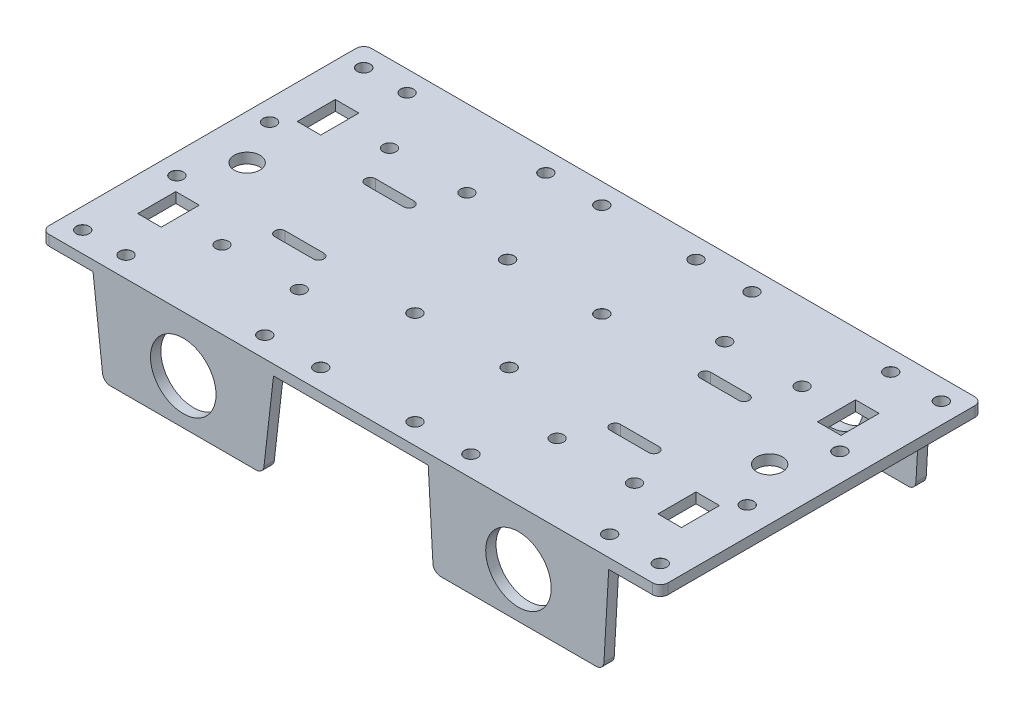
from build123d import *

# Parameters (mm, degrees)
SKETCH_2_W                      = 240
SKETCH_2_H                      = 125
EXTRUDE_1_DEPTH                 = 4
FILLET_1_R                      = 3
SKETCH_4_W                      = 70
SKETCH_4_H                      = 4
EXTRUDE_3_DEPTH                 = 35
CUT_EXTRUDE_1_DEPTH             = 177.776695297
CUT_EXTRUDE_1_DEPTH_BACK        = 177.776695297
CUT_EXTRUDE_2_DEPTH             = 177.776695297
CUT_EXTRUDE_2_DEPTH_BACK        = 177.776695297
FILLET_2_R                      = 3
FILLET_3_R                      = 3
CUT_EXTRUDE_3_DEPTH             = 177.776695297
CUT_EXTRUDE_3_DEPTH_BACK        = 177.776695297
SKETCH_10_R                     = 12.7
CUT_EXTRUDE_4_REACH             = 142.809
SKETCH_11_R                     = 2.5
CUT_EXTRUDE_4_DIRECTION_2_DEPTH = 141.809268161
HOLE_WIZARD_5_0_5_4_D           = 5
HOLE_WIZARD_5_0_5_4_CSINK_D     = 5.05
HOLE_WIZARD_5_0_5_4_CSINK_ANGLE = 90
HOLE_WIZARD_5_0_5_5_D           = 5
HOLE_WIZARD_5_0_5_5_CSINK_D     = 5.05
HOLE_WIZARD_5_0_5_5_CSINK_ANGLE = 90
SKETCH_26_W                     = 9.130018581
SKETCH_26_H                     = 14.776214284
CUT_EXTRUDE_5_DEPTH             = 10
SKETCH_22_R                     = 5
CUT_EXTRUDE_6_DEPTH             = 10


with BuildPart() as part:
    # 草图2 → 凸台-拉伸1 (new body)
    with BuildSketch(Plane(origin=(0, 0, 0), x_dir=(1, 0, 0), z_dir=(0, 1, 0))):
        Rectangle(SKETCH_2_W, SKETCH_2_H)
    extrude(amount=EXTRUDE_1_DEPTH)

    # 圆角1
    fillet_1_edges = [part.edges().sort_by_distance(p)[0] for p in [
        (120, 2, 62.5),
        (-120, 2, 62.5),
        (-120, 2, -62.5),
        (120, 2, -62.5),
    ]]
    fillet(fillet_1_edges, radius=FILLET_1_R)

    # 草图4 → 凸台-拉伸3 (add)
    with BuildSketch(Plane.XZ):
        with Locations((65, 60.5)):
            Rectangle(SKETCH_4_W, SKETCH_4_H)
        with Locations((-65, 60.5)):
            Rectangle(SKETCH_4_W, SKETCH_4_H)
        with Locations((65, -60.5)):
            Rectangle(SKETCH_4_W, SKETCH_4_H)
        with Locations((-65, -60.5)):
            Rectangle(SKETCH_4_W, SKETCH_4_H)
    extrude(amount=EXTRUDE_3_DEPTH)

    # 草图7 → 切除-拉伸1 (cut, two sides: drawn at the far end of the back side and taken through both)
    with BuildSketch(Plane.XY.offset(62.5).offset(-CUT_EXTRUDE_1_DEPTH_BACK)):
        Polygon((-100, 0), (-96, -35), (-100, -35), align=None)
        Polygon((-30, 0), (-34, -35), (-30, -35), align=None)
    extrude(amount=CUT_EXTRUDE_1_DEPTH + CUT_EXTRUDE_1_DEPTH_BACK, mode=Mode.SUBTRACT)

    # 草图9 → 切除-拉伸2 (cut, two sides: drawn at the far end of the back side and taken through both)
    with BuildSketch(Plane.XY.offset(62.5).offset(-CUT_EXTRUDE_2_DEPTH_BACK)):
        Polygon((30, 0), (32, -35), (30, -35), align=None)
        Polygon((98, -35), (100, -35), (100, 0), align=None)
    extrude(amount=CUT_EXTRUDE_2_DEPTH + CUT_EXTRUDE_2_DEPTH_BACK, mode=Mode.SUBTRACT)

    # 圆角2
    fillet_2_edges = [part.edges().sort_by_distance(p)[0] for p in [
        (-96, -35, 60.5),
    ]]
    fillet(fillet_2_edges, radius=FILLET_2_R)

    # 圆角3
    fillet_3_edges = [part.edges().sort_by_distance(p)[0] for p in [
        (98, -35, -60.5),
        (32, -35, -60.5),
        (98, -35, 60.5),
        (32, -35, 60.5),
        (-34, -35, -60.5),
        (-96, -35, -60.5),
        (-34, -35, 60.5),
    ]]
    fillet(fillet_3_edges, radius=FILLET_3_R)

    # 草图10 → 切除-拉伸3 (cut, two sides: drawn at the far end of the back side and taken through both)
    with BuildSketch(Plane.XY.offset(62.5).offset(-CUT_EXTRUDE_3_DEPTH_BACK)):
        with Locations((-65, -17.5)):
            Circle(SKETCH_10_R)
        with Locations(Location((65, -17.5, 0), (0, 0, 180))):
            Circle(SKETCH_10_R)
    extrude(amount=CUT_EXTRUDE_3_DEPTH + CUT_EXTRUDE_3_DEPTH_BACK, mode=Mode.SUBTRACT)

    # 草图11 → 切除-拉伸4 (cut, up to next)
    with BuildSketch(Plane(origin=(0, 4, 0), x_dir=(1, 0, 0), z_dir=(0, 1, 0)), mode=Mode.PRIVATE) as cut_extrude_4_sk1:
        with Locations(Location((-80, -32.5, 0), (0, 0, 90))):
            Circle(SKETCH_11_R)
    cut_extrude_4_tool1 = extrude(cut_extrude_4_sk1.sketch, amount=-CUT_EXTRUDE_4_REACH, mode=Mode.PRIVATE) & part.part
    # 草图11 → 切除-拉伸4 (cut, up to next)
    with BuildSketch(Plane(origin=(0, 4, 0), x_dir=(1, 0, 0), z_dir=(0, 1, 0)), mode=Mode.PRIVATE) as cut_extrude_4_sk2:
        with Locations(Location((-50, -32.5, 0), (0, 0, 90))):
            Circle(SKETCH_11_R)
    cut_extrude_4_tool2 = extrude(cut_extrude_4_sk2.sketch, amount=-CUT_EXTRUDE_4_REACH, mode=Mode.PRIVATE) & part.part
    # 草图11 → 切除-拉伸4 (cut, up to next)
    with BuildSketch(Plane(origin=(0, 4, 0), x_dir=(1, 0, 0), z_dir=(0, 1, 0)), mode=Mode.PRIVATE) as cut_extrude_4_sk3:
        with Locations(Location((-50, 32.5, 0), (0, 0, 90))):
            Circle(SKETCH_11_R)
    cut_extrude_4_tool3 = extrude(cut_extrude_4_sk3.sketch, amount=-CUT_EXTRUDE_4_REACH, mode=Mode.PRIVATE) & part.part
    # 草图11 → 切除-拉伸4 (cut, up to next)
    with BuildSketch(Plane(origin=(0, 4, 0), x_dir=(1, 0, 0), z_dir=(0, 1, 0)), mode=Mode.PRIVATE) as cut_extrude_4_sk4:
        with Locations(Location((-80, 32.5, 0), (0, 0, 90))):
            Circle(SKETCH_11_R)
    cut_extrude_4_tool4 = extrude(cut_extrude_4_sk4.sketch, amount=-CUT_EXTRUDE_4_REACH, mode=Mode.PRIVATE) & part.part
    # 草图11 → 切除-拉伸4 (cut, up to next)
    with BuildSketch(Plane(origin=(0, 4, 0), x_dir=(1, 0, 0), z_dir=(0, 1, 0)), mode=Mode.PRIVATE) as cut_extrude_4_sk5:
        with Locations(Location((50, -32.5, 0), (0, 0, 90))):
            Circle(SKETCH_11_R)
    cut_extrude_4_tool5 = extrude(cut_extrude_4_sk5.sketch, amount=-CUT_EXTRUDE_4_REACH, mode=Mode.PRIVATE) & part.part
    # 草图11 → 切除-拉伸4 (cut, up to next)
    with BuildSketch(Plane(origin=(0, 4, 0), x_dir=(1, 0, 0), z_dir=(0, 1, 0)), mode=Mode.PRIVATE) as cut_extrude_4_sk6:
        with Locations(Location((50, 32.5, 0), (0, 0, 90))):
            Circle(SKETCH_11_R)
    cut_extrude_4_tool6 = extrude(cut_extrude_4_sk6.sketch, amount=-CUT_EXTRUDE_4_REACH, mode=Mode.PRIVATE) & part.part
    # 草图11 → 切除-拉伸4 (cut, up to next)
    with BuildSketch(Plane(origin=(0, 4, 0), x_dir=(1, 0, 0), z_dir=(0, 1, 0)), mode=Mode.PRIVATE) as cut_extrude_4_sk7:
        with Locations(Location((80, -32.5, 0), (0, 0, 90))):
            Circle(SKETCH_11_R)
    cut_extrude_4_tool7 = extrude(cut_extrude_4_sk7.sketch, amount=-CUT_EXTRUDE_4_REACH, mode=Mode.PRIVATE) & part.part
    # 草图11 → 切除-拉伸4 (cut, up to next)
    with BuildSketch(Plane(origin=(0, 4, 0), x_dir=(1, 0, 0), z_dir=(0, 1, 0)), mode=Mode.PRIVATE) as cut_extrude_4_sk8:
        with Locations(Location((80, 32.5, 0), (0, 0, 90))):
            Circle(SKETCH_11_R)
    cut_extrude_4_tool8 = extrude(cut_extrude_4_sk8.sketch, amount=-CUT_EXTRUDE_4_REACH, mode=Mode.PRIVATE) & part.part
    # 草图11 → 切除-拉伸4 (cut, up to next)
    with BuildSketch(Plane(origin=(0, 4, 0), x_dir=(1, 0, 0), z_dir=(0, 1, 0)), mode=Mode.PRIVATE) as cut_extrude_4_sk9:
        with BuildLine():
            Line((-72.5, -15.5), (-57.5, -15.5))
            ThreePointArc((-57.5, -15.5), (-55.5, -17.5), (-57.5, -19.5))
            Line((-57.5, -19.5), (-72.5, -19.5))
            ThreePointArc((-72.5, -19.5), (-74.5, -17.5), (-72.5, -15.5))
        make_face()
    cut_extrude_4_tool9 = extrude(cut_extrude_4_sk9.sketch, amount=-CUT_EXTRUDE_4_REACH, mode=Mode.PRIVATE) & part.part
    # 草图11 → 切除-拉伸4 (cut, up to next)
    with BuildSketch(Plane(origin=(0, 4, 0), x_dir=(1, 0, 0), z_dir=(0, 1, 0)), mode=Mode.PRIVATE) as cut_extrude_4_sk10:
        with BuildLine():
            Line((-72.5, 15.5), (-57.5, 15.5))
            ThreePointArc((-57.5, 15.5), (-55.5, 17.5), (-57.5, 19.5))
            Line((-57.5, 19.5), (-72.5, 19.5))
            ThreePointArc((-72.5, 19.5), (-74.5, 17.5), (-72.5, 15.5))
        make_face()
    cut_extrude_4_tool10 = extrude(cut_extrude_4_sk10.sketch, amount=-CUT_EXTRUDE_4_REACH, mode=Mode.PRIVATE) & part.part
    # 草图11 → 切除-拉伸4 (cut, up to next)
    with BuildSketch(Plane(origin=(0, 4, 0), x_dir=(1, 0, 0), z_dir=(0, 1, 0)), mode=Mode.PRIVATE) as cut_extrude_4_sk11:
        with BuildLine():
            Line((72.5, -15.5), (57.5, -15.5))
            ThreePointArc((57.5, -15.5), (55.5, -17.5), (57.5, -19.5))
            Line((57.5, -19.5), (72.5, -19.5))
            ThreePointArc((72.5, -19.5), (74.5, -17.5), (72.5, -15.5))
        make_face()
    cut_extrude_4_tool11 = extrude(cut_extrude_4_sk11.sketch, amount=-CUT_EXTRUDE_4_REACH, mode=Mode.PRIVATE) & part.part
    # 草图11 → 切除-拉伸4 (cut, up to next)
    with BuildSketch(Plane(origin=(0, 4, 0), x_dir=(1, 0, 0), z_dir=(0, 1, 0)), mode=Mode.PRIVATE) as cut_extrude_4_sk12:
        with BuildLine():
            Line((72.5, 15.5), (57.5, 15.5))
            ThreePointArc((57.5, 15.5), (55.5, 17.5), (57.5, 19.5))
            Line((57.5, 19.5), (72.5, 19.5))
            ThreePointArc((72.5, 19.5), (74.5, 17.5), (72.5, 15.5))
        make_face()
    cut_extrude_4_tool12 = extrude(cut_extrude_4_sk12.sketch, amount=-CUT_EXTRUDE_4_REACH, mode=Mode.PRIVATE) & part.part
    add(cut_extrude_4_tool1.solids().sort_by_distance((-80, 4, 32.5))[0], mode=Mode.SUBTRACT)
    add(cut_extrude_4_tool2.solids().sort_by_distance((-50, 4, 32.5))[0], mode=Mode.SUBTRACT)
    add(cut_extrude_4_tool3.solids().sort_by_distance((-50, 4, -32.5))[0], mode=Mode.SUBTRACT)
    add(cut_extrude_4_tool4.solids().sort_by_distance((-80, 4, -32.5))[0], mode=Mode.SUBTRACT)
    add(cut_extrude_4_tool5.solids().sort_by_distance((50, 4, 32.5))[0], mode=Mode.SUBTRACT)
    add(cut_extrude_4_tool6.solids().sort_by_distance((50, 4, -32.5))[0], mode=Mode.SUBTRACT)
    add(cut_extrude_4_tool7.solids().sort_by_distance((80, 4, 32.5))[0], mode=Mode.SUBTRACT)
    add(cut_extrude_4_tool8.solids().sort_by_distance((80, 4, -32.5))[0], mode=Mode.SUBTRACT)
    add(cut_extrude_4_tool9.solids().sort_by_distance((-65, 4, 17.5))[0], mode=Mode.SUBTRACT)
    add(cut_extrude_4_tool10.solids().sort_by_distance((-65, 4, -17.5))[0], mode=Mode.SUBTRACT)
    add(cut_extrude_4_tool11.solids().sort_by_distance((65, 4, 17.5))[0], mode=Mode.SUBTRACT)
    add(cut_extrude_4_tool12.solids().sort_by_distance((65, 4, -17.5))[0], mode=Mode.SUBTRACT)

    # 草图11 → 切除-拉伸4 direction 2 (cut)
    with BuildSketch(Plane(origin=(0, 4, 0), x_dir=(1, 0, 0), z_dir=(0, 1, 0))):
        with Locations(Location((-80, -32.5, 0), (0, 0, 90))):
            Circle(SKETCH_11_R)
        with Locations(Location((-50, -32.5, 0), (0, 0, 90))):
            Circle(SKETCH_11_R)
        with Locations(Location((-50, 32.5, 0), (0, 0, 90))):
            Circle(SKETCH_11_R)
        with Locations(Location((-80, 32.5, 0), (0, 0, 90))):
            Circle(SKETCH_11_R)
        with Locations(Location((50, -32.5, 0), (0, 0, 90))):
            Circle(SKETCH_11_R)
        with Locations(Location((50, 32.5, 0), (0, 0, 90))):
            Circle(SKETCH_11_R)
        with Locations(Location((80, -32.5, 0), (0, 0, 90))):
            Circle(SKETCH_11_R)
        with Locations(Location((80, 32.5, 0), (0, 0, 90))):
            Circle(SKETCH_11_R)
        with BuildLine():
            Line((-72.5, -15.5), (-57.5, -15.5))
            ThreePointArc((-57.5, -15.5), (-55.5, -17.5), (-57.5, -19.5))
            Line((-57.5, -19.5), (-72.5, -19.5))
            ThreePointArc((-72.5, -19.5), (-74.5, -17.5), (-72.5, -15.5))
        make_face()
        with BuildLine():
            Line((-72.5, 15.5), (-57.5, 15.5))
            ThreePointArc((-57.5, 15.5), (-55.5, 17.5), (-57.5, 19.5))
            Line((-57.5, 19.5), (-72.5, 19.5))
            ThreePointArc((-72.5, 19.5), (-74.5, 17.5), (-72.5, 15.5))
        make_face()
        with BuildLine():
            Line((72.5, -15.5), (57.5, -15.5))
            ThreePointArc((57.5, -15.5), (55.5, -17.5), (57.5, -19.5))
            Line((57.5, -19.5), (72.5, -19.5))
            ThreePointArc((72.5, -19.5), (74.5, -17.5), (72.5, -15.5))
        make_face()
        with BuildLine():
            Line((72.5, 15.5), (57.5, 15.5))
            ThreePointArc((57.5, 15.5), (55.5, 17.5), (57.5, 19.5))
            Line((57.5, 19.5), (72.5, 19.5))
            ThreePointArc((72.5, 19.5), (74.5, 17.5), (72.5, 15.5))
        make_face()
    extrude(amount=CUT_EXTRUDE_4_DIRECTION_2_DEPTH, mode=Mode.SUBTRACT)

    # Ø5.0 (5) 直径孔4 (through all)
    with Locations(Plane(origin=(0, 4, 0), x_dir=(1, 0, 0), z_dir=(0, 1, 0))):
        with Locations((-112, 54.5), (-112, -54.5), (112, -54.5), (112, 54.5)):
            CounterSinkHole(HOLE_WIZARD_5_0_5_4_D / 2, HOLE_WIZARD_5_0_5_4_CSINK_D / 2, counter_sink_angle=HOLE_WIZARD_5_0_5_4_CSINK_ANGLE)

    # Ø5.0 (5) 直径孔5 (through all)
    with Locations(Plane(origin=(0, 4, 0), x_dir=(1, 0, 0), z_dir=(0, 1, 0))):
        with Locations((-95.192123364, 54.5), (-41.370416483, 54.5), (-19.681071919, 54.5), (-19.681071919, 17.973880171), (-112, 17.973880171), (-112, -17.973880171), (-95.192123364, -54.5), (-41.370416483, -54.5), (-19.681071919, -54.5), (-19.681071919, -17.973880171), (16.869490216, 17.973880171), (16.869490216, -17.973880171), (16.869490216, 54.5), (38.55883478, 54.5), (92.380541661, 54.5), (109.188418297, 17.973880171), (109.188418297, -17.973880171), (92.380541661, -54.5), (38.55883478, -54.5), (16.869490216, -54.5)):
            CounterSinkHole(HOLE_WIZARD_5_0_5_5_D / 2, HOLE_WIZARD_5_0_5_5_CSINK_D / 2, counter_sink_angle=HOLE_WIZARD_5_0_5_5_CSINK_ANGLE)

    # 草图26 → 切除-拉伸5 (cut)
    with BuildSketch(Plane(origin=(0, 4, 0), x_dir=(1, 0, 0), z_dir=(0, 1, 0))):
        with Locations((-102.29021779, 30.941404151)):
            Rectangle(SKETCH_26_W, SKETCH_26_H)
        with Locations((-102.29021779, -30.941404151)):
            Rectangle(SKETCH_26_W, SKETCH_26_H)
        with Locations((99.478636087, -30.941404151)):
            Rectangle(SKETCH_26_W, SKETCH_26_H)
        with Locations((99.478636087, 30.941404151)):
            Rectangle(SKETCH_26_W, SKETCH_26_H)
    extrude(amount=-CUT_EXTRUDE_5_DEPTH, mode=Mode.SUBTRACT)

    # 草图22 → 切除-拉伸6 (cut)
    with BuildSketch(Plane(origin=(0, 4, 0), x_dir=(1, 0, 0), z_dir=(0, 1, 0))):
        with Locations(Location((-102.73836527, 0, 0), (0, 0, 270))):
            Circle(SKETCH_22_R)
        with Locations(Location((99.926783567, 0, 0), (0, 0, 90))):
            Circle(SKETCH_22_R)
    extrude(amount=-CUT_EXTRUDE_6_DEPTH, mode=Mode.SUBTRACT)


solid = part.part
